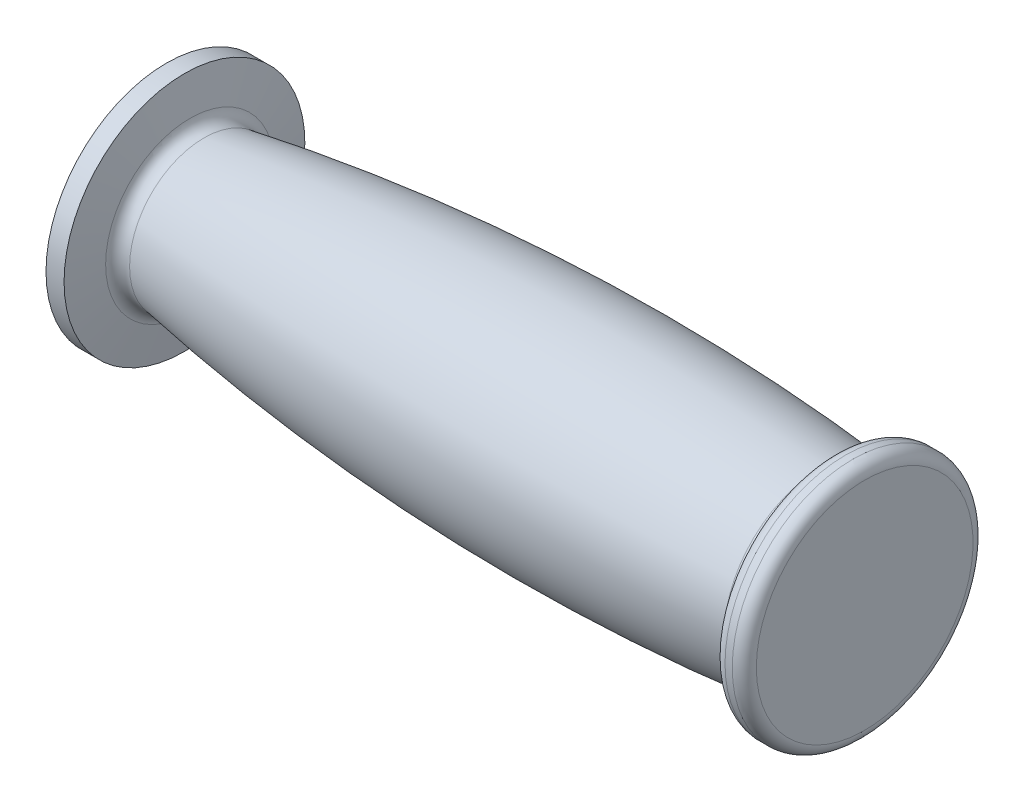
from build123d import *

# Parameters (mm, degrees)
VERRUNDUNG2_R = 2


with BuildPart() as part:
    # Skizze1 → Rotation1 (revolve)
    with BuildSketch(Plane.XY, mode=Mode.PRIVATE) as rotation1_sk:
        with BuildLine():
            Line((0, 0), (0, 5))
            Line((0, 5), (5, 5))
            Line((5, 5), (5, 7))
            Line((5, 7), (7, 7))
            Line((7, 7), (9, 20))
            Line((9, 20), (12, 20))
            Line((12, 20), (13.230769231, 12))
            ThreePointArc((13.230769231, 12), (66.260269777, 17.573625101), (119.549389559, 15.712728033))
            Line((119.549389559, 15.712728033), (120, 20))
            Line((120, 20), (125, 20))
            Line((125, 20), (125, 0))
            Line((125, 0), (0, 0))
        make_face()
    revolve(rotation1_sk.sketch.rotate(Axis((0, 0, 0), (1, 0, 0)), 90), axis=Axis((0, 0, 0), (1, 0, 0)))

    # Verrundung2
    verrundung2_edges = [part.edges().sort_by_distance(p)[0] for p in [
        (13.230769231, 0, -12),
        (125, 0, -20),
        (120, 0, -20),
        (119.549389559, 0, -15.712728033),
    ]]
    fillet(verrundung2_edges, radius=VERRUNDUNG2_R)


solid = part.part
